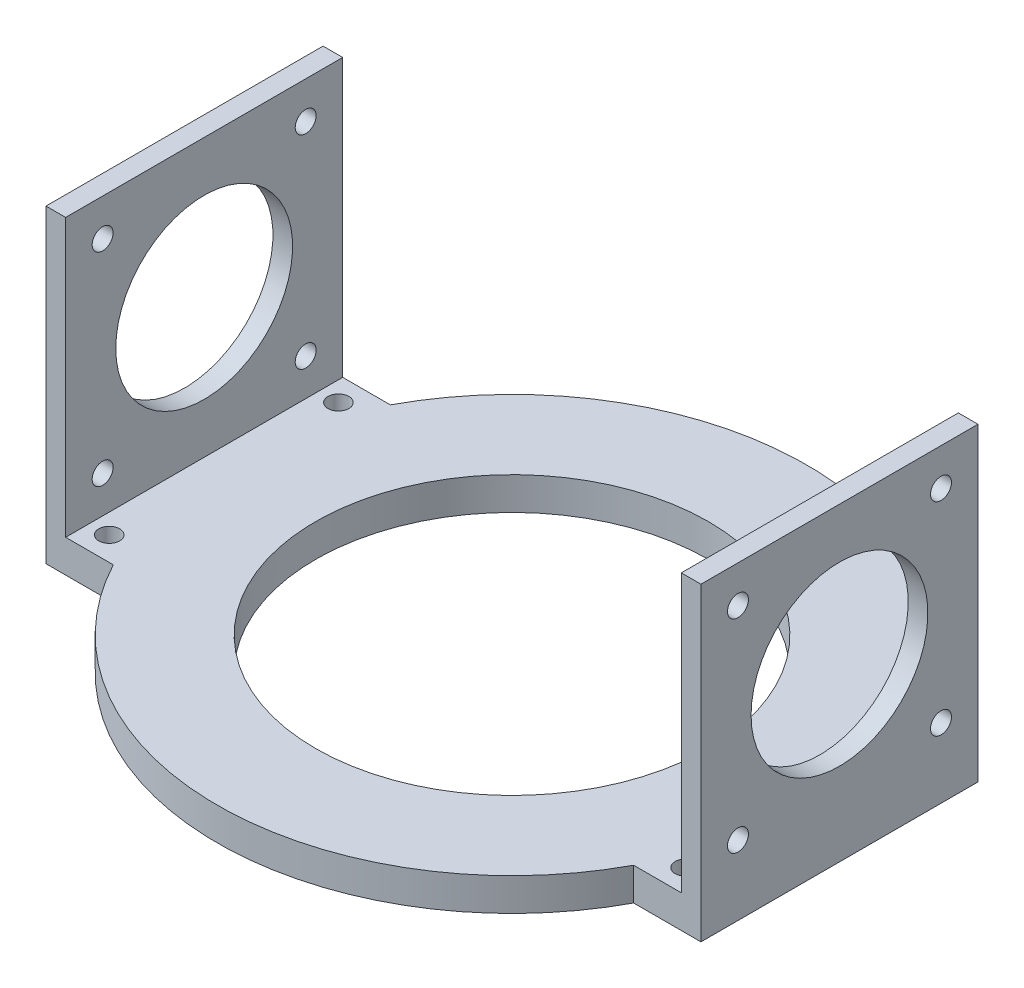
from build123d import *

# Parameters (mm, degrees)
BODY_DEPTH                = 5
SKETCH4_W                 = 3
SKETCH4_H                 = 42.3
EXTRUDE_WING_DEPTH        = 42.3
SKETCH5_R                 = 1.6
SKETCH5_R_2               = 13.5
CUT_MOTOR_HOLES_DEPTH     = 120.424829914
CUT_EXCESS_MATERIAL_REACH = 84.233
SKETCH8_R                 = 30
CUT_DECK_HOLES_REACH      = 81.463
SKETCH9_R                 = 1.6


with BuildPart() as part:
    # Sketch1 → body (new body)
    with BuildSketch(Plane(origin=(0, 0, 0), x_dir=(1, 0, 0), z_dir=(0, 1, 0))):
        with BuildLine():
            Line((-39.719988671, 21.15), (-50, 21.15))
            Line((-50, 21.15), (-50, -21.15))
            Line((-50, -21.15), (-39.719988671, -21.15))
            ThreePointArc((-39.719988671, -21.15), (0, -45), (39.719988671, -21.15))
            Line((39.719988671, -21.15), (50, -21.15))
            Line((50, -21.15), (50, 21.15))
            Line((50, 21.15), (39.719988671, 21.15))
            ThreePointArc((39.719988671, 21.15), (0, 45), (-39.719988671, 21.15))
        make_face()
    extrude(amount=BODY_DEPTH)

    # Sketch4 → extrude-wing (add)
    with BuildSketch(Plane(origin=(0, 5, 0), x_dir=(1, 0, 0), z_dir=(0, 1, 0))):
        with Locations((-48.5, 0)):
            Rectangle(SKETCH4_W, SKETCH4_H)
        with Locations((48.5, 0)):
            Rectangle(SKETCH4_W, SKETCH4_H)
    extrude(amount=EXTRUDE_WING_DEPTH)

    # Sketch5 → cut-motor-holes (cut, through all)
    with BuildSketch(Plane.ZY.offset(50)):
        with Locations((-15.5, 41.65)):
            Circle(SKETCH5_R)
        with Locations((15.5, 41.65)):
            Circle(SKETCH5_R)
        with Locations((15.5, 10.65)):
            Circle(SKETCH5_R)
        with Locations((-15.5, 10.65)):
            Circle(SKETCH5_R)
        with Locations((0, 26.15)):
            Circle(SKETCH5_R_2)
    extrude(amount=-CUT_MOTOR_HOLES_DEPTH, mode=Mode.SUBTRACT)

    # Sketch8 → cut-excess-material (cut, up to next)
    with BuildSketch(Plane.XZ, mode=Mode.PRIVATE) as cut_excess_material_sk1:
        with Locations(Location((0, 0, 0), (0, 0, 270))):
            Circle(SKETCH8_R)
    cut_excess_material_tool1 = extrude(cut_excess_material_sk1.sketch, amount=-CUT_EXCESS_MATERIAL_REACH, mode=Mode.PRIVATE) & part.part
    add(cut_excess_material_tool1.solids().sort_by_distance((0, 0, 0))[0], mode=Mode.SUBTRACT)

    # Sketch9 → cut-deck-holes (cut, up to next)
    with BuildSketch(Plane(origin=(0, 5, 0), x_dir=(1, 0, 0), z_dir=(0, 1, 0)), mode=Mode.PRIVATE) as cut_deck_holes_sk1:
        with Locations(Location((44, -17.5, 0), (0, 0, 270))):
            Circle(SKETCH9_R)
    cut_deck_holes_tool1 = extrude(cut_deck_holes_sk1.sketch, amount=-CUT_DECK_HOLES_REACH, mode=Mode.PRIVATE) & part.part
    # Sketch9 → cut-deck-holes (cut, up to next)
    with BuildSketch(Plane(origin=(0, 5, 0), x_dir=(1, 0, 0), z_dir=(0, 1, 0)), mode=Mode.PRIVATE) as cut_deck_holes_sk2:
        with Locations(Location((44, 17.5, 0), (0, 0, 270))):
            Circle(SKETCH9_R)
    cut_deck_holes_tool2 = extrude(cut_deck_holes_sk2.sketch, amount=-CUT_DECK_HOLES_REACH, mode=Mode.PRIVATE) & part.part
    # Sketch9 → cut-deck-holes (cut, up to next)
    with BuildSketch(Plane(origin=(0, 5, 0), x_dir=(1, 0, 0), z_dir=(0, 1, 0)), mode=Mode.PRIVATE) as cut_deck_holes_sk3:
        with Locations(Location((-44, 17.5, 0), (0, 0, 270))):
            Circle(SKETCH9_R)
    cut_deck_holes_tool3 = extrude(cut_deck_holes_sk3.sketch, amount=-CUT_DECK_HOLES_REACH, mode=Mode.PRIVATE) & part.part
    # Sketch9 → cut-deck-holes (cut, up to next)
    with BuildSketch(Plane(origin=(0, 5, 0), x_dir=(1, 0, 0), z_dir=(0, 1, 0)), mode=Mode.PRIVATE) as cut_deck_holes_sk4:
        with Locations(Location((-44, -17.5, 0), (0, 0, 270))):
            Circle(SKETCH9_R)
    cut_deck_holes_tool4 = extrude(cut_deck_holes_sk4.sketch, amount=-CUT_DECK_HOLES_REACH, mode=Mode.PRIVATE) & part.part
    add(cut_deck_holes_tool1.solids().sort_by_distance((44, 5, 17.5))[0], mode=Mode.SUBTRACT)
    add(cut_deck_holes_tool2.solids().sort_by_distance((44, 5, -17.5))[0], mode=Mode.SUBTRACT)
    add(cut_deck_holes_tool3.solids().sort_by_distance((-44, 5, -17.5))[0], mode=Mode.SUBTRACT)
    add(cut_deck_holes_tool4.solids().sort_by_distance((-44, 5, 17.5))[0], mode=Mode.SUBTRACT)


solid = part.part
